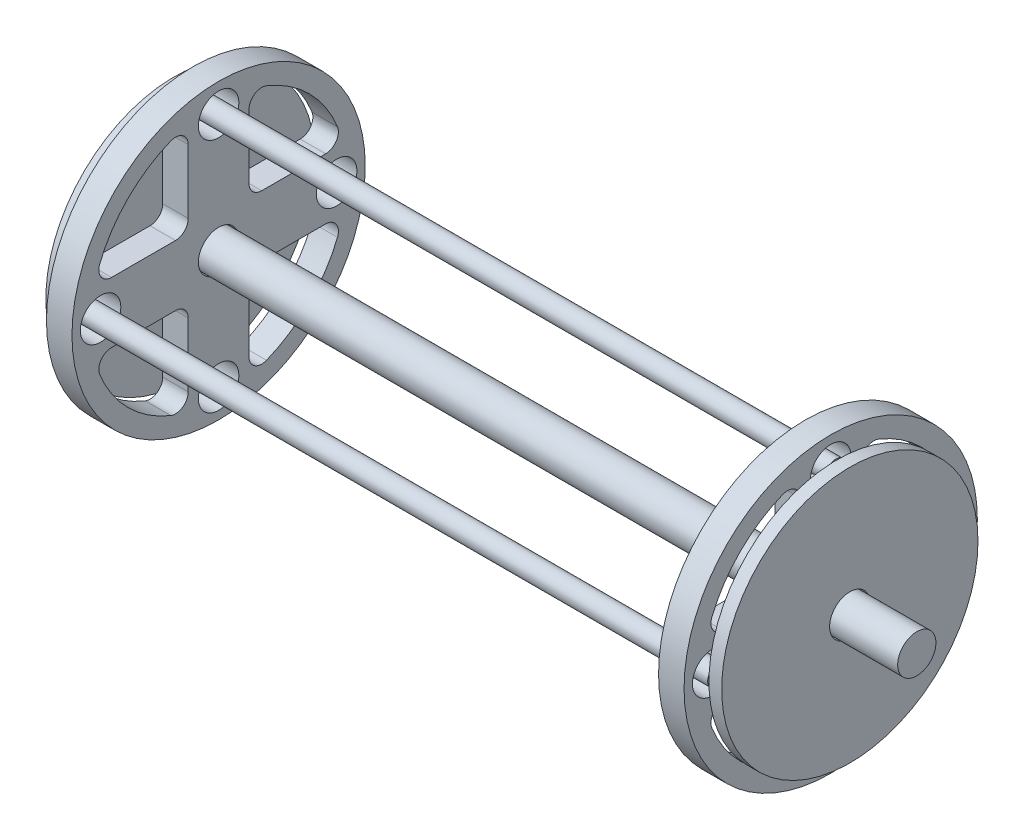
from build123d import *

# Parameters (mm, degrees)
SKETCH1_R             = 3
BOSS_EXTRUDE1_DEPTH   = 63.5
SKETCH2_R             = 23
SKETCH2_R_2           = 3.175
BOSS_EXTRUDE2_DEPTH   = 4
SKETCH3_R             = 20.1
SKETCH3_R_2           = 3.175
BOSS_EXTRUDE3_DEPTH   = 2
SKETCH4_R             = 1.5875
BOSS_EXTRUDE4_DEPTH   = 50.8
BOSS_EXTRUDE4_2_DEPTH = 50.8
BOSS_EXTRUDE4_3_DEPTH = 50.8
BOSS_EXTRUDE4_4_DEPTH = 50.8


with BuildPart() as part:
    # Sketch1 → Boss-Extrude1 (new, symmetric)
    with BuildSketch(Plane(origin=(0, 0, 0), x_dir=(0, 0, -1), z_dir=(1, 0, 0))):
        Circle(SKETCH1_R)
    extrude(amount=BOSS_EXTRUDE1_DEPTH, both=True)


with BuildPart() as body_2:
    # Sketch2 → Boss-Extrude2 (new body)
    with BuildSketch(Plane(origin=(46, 0, 0), x_dir=(0, 0, -1), z_dir=(1, 0, 0))):
        Circle(SKETCH2_R)
        Circle(SKETCH2_R_2, mode=Mode.SUBTRACT)
        with Locations((0, 18.5125)):
            Circle(SKETCH2_R_2, mode=Mode.SUBTRACT)
        with Locations((-18.5125, 0)):
            Circle(SKETCH2_R_2, mode=Mode.SUBTRACT)
        with Locations((0, -18.5125)):
            Circle(SKETCH2_R_2, mode=Mode.SUBTRACT)
        with Locations((18.5125, 0)):
            Circle(SKETCH2_R_2, mode=Mode.SUBTRACT)
        with BuildLine():
            Line((4.7625, 6.7625), (4.7625, 16.789240416))
            ThreePointArc((4.7625, 16.789240416), (5.643231296, 18.446719698), (7.509737569, 18.644405103))
            ThreePointArc((7.509737569, 18.644405103), (14.212846302, 14.212846302), (18.644405103, 7.509737569))
            ThreePointArc((18.644405103, 7.509737569), (18.446719698, 5.643231296), (16.789240416, 4.7625))
            Line((16.789240416, 4.7625), (6.7625, 4.7625))
            ThreePointArc((6.7625, 4.7625), (5.348286438, 5.348286438), (4.7625, 6.7625))
        make_face(mode=Mode.SUBTRACT)
        with BuildLine():
            Line((6.7625, -4.7625), (16.789240416, -4.7625))
            ThreePointArc((16.789240416, -4.7625), (18.446719698, -5.643231296), (18.644405103, -7.509737569))
            ThreePointArc((18.644405103, -7.509737569), (14.212846302, -14.212846302), (7.509737569, -18.644405103))
            ThreePointArc((7.509737569, -18.644405103), (5.643231296, -18.446719698), (4.7625, -16.789240416))
            Line((4.7625, -16.789240416), (4.7625, -6.7625))
            ThreePointArc((4.7625, -6.7625), (5.348286438, -5.348286438), (6.7625, -4.7625))
        make_face(mode=Mode.SUBTRACT)
        with BuildLine():
            Line((-4.7625, -6.7625), (-4.7625, -16.789240416))
            ThreePointArc((-4.7625, -16.789240416), (-5.643231296, -18.446719698), (-7.509737569, -18.644405103))
            ThreePointArc((-7.509737569, -18.644405103), (-14.212846302, -14.212846302), (-18.644405103, -7.509737569))
            ThreePointArc((-18.644405103, -7.509737569), (-18.446719698, -5.643231296), (-16.789240416, -4.7625))
            Line((-16.789240416, -4.7625), (-6.7625, -4.7625))
            ThreePointArc((-6.7625, -4.7625), (-5.348286438, -5.348286438), (-4.7625, -6.7625))
        make_face(mode=Mode.SUBTRACT)
        with BuildLine():
            Line((-6.7625, 4.7625), (-16.789240416, 4.7625))
            ThreePointArc((-16.789240416, 4.7625), (-18.446719698, 5.643231296), (-18.644405103, 7.509737569))
            ThreePointArc((-18.644405103, 7.509737569), (-14.212846302, 14.212846302), (-7.509737569, 18.644405103))
            ThreePointArc((-7.509737569, 18.644405103), (-5.643231296, 18.446719698), (-4.7625, 16.789240416))
            Line((-4.7625, 16.789240416), (-4.7625, 6.7625))
            ThreePointArc((-4.7625, 6.7625), (-5.348286438, 5.348286438), (-6.7625, 4.7625))
        make_face(mode=Mode.SUBTRACT)
    extrude(amount=BOSS_EXTRUDE2_DEPTH)


with BuildPart() as body_3:
    # Sketch3 → Boss-Extrude3 (new body)
    with BuildSketch(Plane(origin=(51, 0, 0), x_dir=(0, 0, -1), z_dir=(1, 0, 0))):
        Circle(SKETCH3_R)
        Circle(SKETCH3_R_2, mode=Mode.SUBTRACT)
    extrude(amount=BOSS_EXTRUDE3_DEPTH)


with BuildPart() as body_4:
    # Sketch4 → Boss-Extrude4 (new, symmetric)
    with BuildSketch(Plane(origin=(0, 0, 0), x_dir=(0, 0, -1), z_dir=(1, 0, 0))):
        with Locations((0, 18.5125)):
            Circle(SKETCH4_R)
    extrude(amount=BOSS_EXTRUDE4_DEPTH, both=True)


with BuildPart() as body_5:
    # Sketch4 → Boss-Extrude4 2 (new, symmetric)
    with BuildSketch(Plane(origin=(0, 0, 0), x_dir=(0, 0, -1), z_dir=(1, 0, 0))):
        with Locations((-18.5125, 0)):
            Circle(SKETCH4_R)
    extrude(amount=BOSS_EXTRUDE4_2_DEPTH, both=True)


with BuildPart() as body_6:
    # Sketch4 → Boss-Extrude4 3 (new, symmetric)
    with BuildSketch(Plane(origin=(0, 0, 0), x_dir=(0, 0, -1), z_dir=(1, 0, 0))):
        with Locations((18.5125, 0)):
            Circle(SKETCH4_R)
    extrude(amount=BOSS_EXTRUDE4_3_DEPTH, both=True)


with BuildPart() as body_7:
    # Sketch4 → Boss-Extrude4 4 (new, symmetric)
    with BuildSketch(Plane(origin=(0, 0, 0), x_dir=(0, 0, -1), z_dir=(1, 0, 0))):
        with Locations((0, -18.5125)):
            Circle(SKETCH4_R)
    extrude(amount=BOSS_EXTRUDE4_4_DEPTH, both=True)


with BuildPart() as body_8:
    # Mirror5: mirrored copy
    add(body_3.part.mirror(Plane(origin=(0, 0, 0), x_dir=(0, 0, 1), z_dir=(1, 0, 0))))


with BuildPart() as body_9:
    # Mirror5 2: mirrored copy
    add(body_2.part.mirror(Plane(origin=(0, 0, 0), x_dir=(0, 0, 1), z_dir=(1, 0, 0))))


solid = Compound([part.part, body_2.part, body_3.part, body_4.part, body_5.part, body_6.part, body_7.part, body_8.part, body_9.part])
